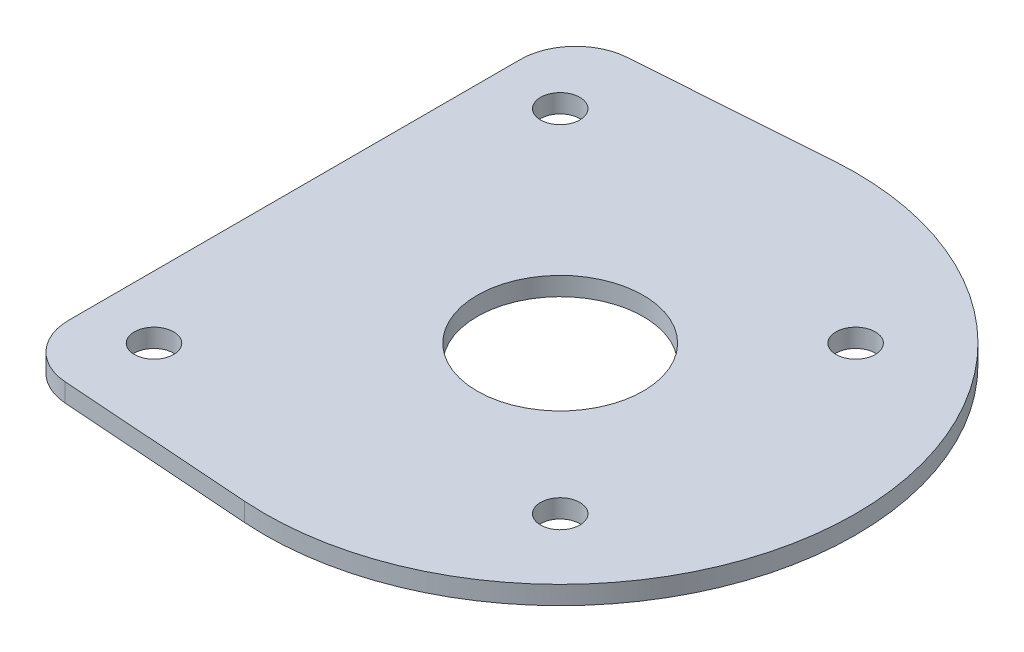
from build123d import *

# Parameters (mm, degrees)
SKETCH1_R               = 14.28115
SKETCH1_R_2             = 19.177
BOSS_EXTRUDE1_DEPTH     = 3.175
F_10_CLEARANCE_HOLE1_D  = 5.1054
F_1_4_CLEARANCE_HOLE1_D = 6.7564
SKETCH6_R               = 2.5527
CUT_EXTRUDE1_DEPTH      = 150.23740385
FILLET1_R               = 7.62
CUT_EXTRUDE2_DEPTH      = 150.23740385
FILLET2_R               = 9.525


with BuildPart() as part:
    # Sketch1 → Boss-Extrude1 (new body)
    with BuildSketch(Plane(origin=(0, 0, 0), x_dir=(1, 0, 0), z_dir=(0, 1, 0))):
        with BuildLine():
            Line((85.884602434, 50.671947857), (-3.15409287, 44.337954375))
            ThreePointArc((-3.15409287, 44.337954375), (-44.45, 0), (-3.15409287, -44.337954375))
            Line((-3.15409287, -44.337954375), (85.884602434, -50.671947857))
            ThreePointArc((85.884602434, -50.671947857), (140.28928, 0), (85.884602434, 50.671947857))
        make_face()
        with Locations(Location((89.48928, 0, 0), (0, 0, 270))):
            Circle(SKETCH1_R, mode=Mode.SUBTRACT)
        with Locations(Location((0, 0, 0), (0, 0, 270))):
            Circle(SKETCH1_R_2, mode=Mode.SUBTRACT)
    extrude(amount=BOSS_EXTRUDE1_DEPTH)

    # #10 Clearance Hole1 (through all)
    with Locations(Plane(origin=(0, 3.175, 0), x_dir=(1, 0, 0), z_dir=(0, 1, 0))):
        with Locations((-17.960512242, 17.960512242), (17.960512242, 17.960512242), (17.960512242, -17.960512242), (-17.960512242, -17.960512242), (-31.8135, 0), (34.925, 34.314713318), (34.925, -34.314713318)):
            Hole(F_10_CLEARANCE_HOLE1_D / 2)

    # 1/4 Clearance Hole1 (through all)
    with Locations(Plane(origin=(0, 3.175, 0), x_dir=(1, 0, 0), z_dir=(0, 1, 0))):
        with Locations((54.56428, 34.925), (54.56428, -34.925), (114.88928, 25.4), (114.88928, -25.4)):
            Hole(F_1_4_CLEARANCE_HOLE1_D / 2)

    # Sketch6 → Cut-Extrude1 (cut, through all)
    # profile 1 of 2: a face of its own
    with BuildSketch(Plane(origin=(0, 3.175, 0), x_dir=(1, 0, 0), z_dir=(0, 1, 0))):
        with BuildLine():
            Line((-9.48365621, 16.667861107), (-14.368409794, 21.552614691))
            ThreePointArc((-14.368409794, 21.552614691), (-21.552614691, 21.552614691), (-21.552614691, 14.368409794))
            Line((-21.552614691, 14.368409794), (-16.667861107, 9.48365621))
            ThreePointArc((-16.667861107, 9.48365621), (-13.560186743, 13.560186743), (-9.48365621, 16.667861107))
        make_face()
        with Locations((-17.960512242, 17.960512242)):
            Circle(SKETCH6_R, mode=Mode.SUBTRACT)
    # profile 2 of 2: a face of its own
    with BuildSketch(Plane(origin=(0, 3.175, 0), x_dir=(1, 0, 0), z_dir=(0, 1, 0))):
        with BuildLine():
            ThreePointArc((16.667861107, -9.48365621), (13.560186743, -13.560186743), (9.48365621, -16.667861107))
            Line((9.48365621, -16.667861107), (14.368409794, -21.552614691))
            ThreePointArc((14.368409794, -21.552614691), (21.552614691, -21.552614691), (21.552614691, -14.368409794))
            Line((21.552614691, -14.368409794), (16.667861107, -9.48365621))
        make_face()
        with Locations((17.960512242, -17.960512242)):
            Circle(SKETCH6_R, mode=Mode.SUBTRACT)
    extrude(amount=-CUT_EXTRUDE1_DEPTH, mode=Mode.SUBTRACT)

    # Fillet1
    fillet1_edges = [part.edges().sort_by_distance(p)[0] for p in [
        (9.48365621, 1.5875, 16.667861107),
        (16.667861107, 1.5875, 9.48365621),
        (-9.48365621, 1.5875, -16.667861107),
        (-16.667861107, 1.5875, -9.48365621),
    ]]
    fillet(fillet1_edges, radius=FILLET1_R)

    # Sketch7 → Cut-Extrude2 (cut, through all)
    with BuildSketch(Plane(origin=(0, 3.175, 0), x_dir=(1, 0, 0), z_dir=(0, 1, 0))):
        Polygon((43.815, 47.679219957), (43.815, -47.679219957), (-626.42496, 0), align=None)
    extrude(amount=-CUT_EXTRUDE2_DEPTH, mode=Mode.SUBTRACT)

    # Fillet2
    fillet2_edges = [part.edges().sort_by_distance(p)[0] for p in [
        (43.815, 1.5875, 47.679219957),
        (43.815, 1.5875, -47.679219957),
    ]]
    fillet(fillet2_edges, radius=FILLET2_R)


solid = part.part
